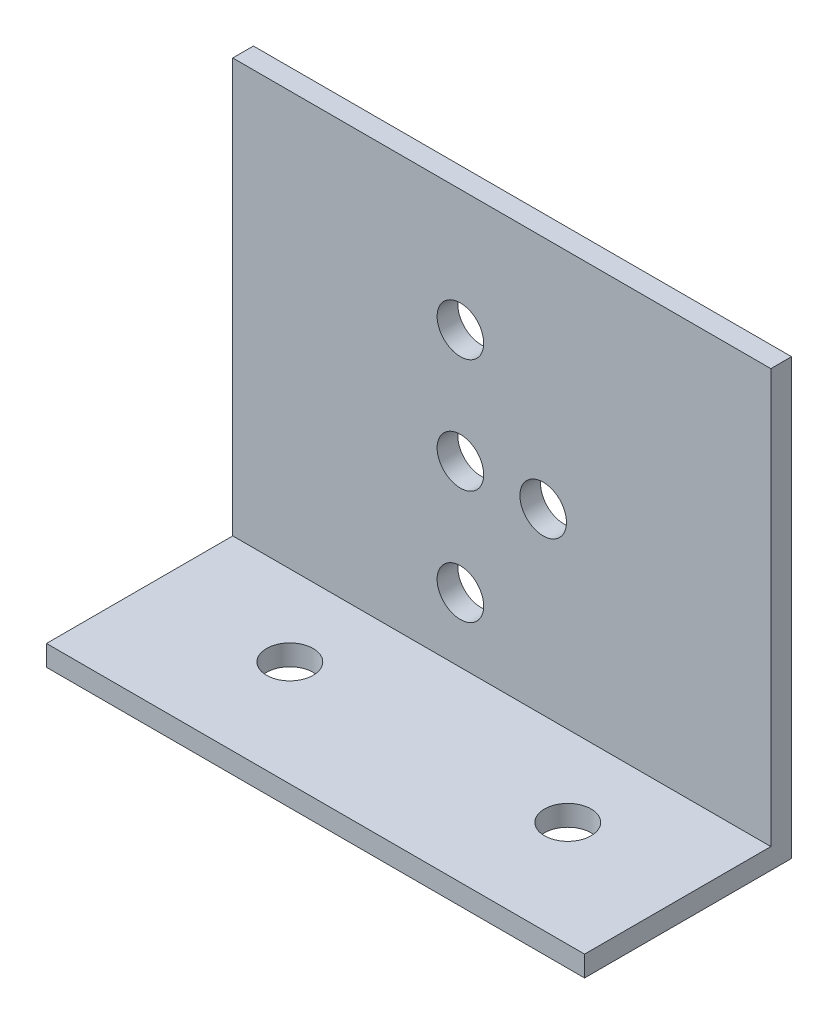
from build123d import *

# Parameters (mm, degrees)
ESQUISSE1_W             = 52
ESQUISSE1_H             = 42
BOSS_EXTRU_1_DEPTH      = 20
ESQUISSE2_W             = 66.008627658
ESQUISSE2_H             = 40.946179855
ENL_V_MAT_EXTRU_1_DEPTH = 40
D_GAGEMENT_M41_D        = 4.5
D_GAGEMENT_M42_D        = 4.5


with BuildPart() as part:
    # Esquisse1 → Boss.-Extru.1 (new body)
    with BuildSketch(Plane.XY):
        Rectangle(ESQUISSE1_W, ESQUISSE1_H)
    extrude(amount=BOSS_EXTRU_1_DEPTH)

    # Esquisse2 → Enlèv. mat.-Extru.1 (cut)
    with BuildSketch(Plane(origin=(0, 21, 0), x_dir=(1, 0, 0), z_dir=(0, 1, 0))):
        with Locations((1.405901571, -22.473089928)):
            Rectangle(ESQUISSE2_W, ESQUISSE2_H)
    extrude(amount=-ENL_V_MAT_EXTRU_1_DEPTH, mode=Mode.SUBTRACT)

    # Dégagement M41 (through all)
    with Locations(Plane(origin=(0, 0, 0), x_dir=(-1, 0, 0), z_dir=(0, 0, -1))):
        with Locations((4, -12.75), (4, -1.75), (4, 9.25), (-4, -1.75)):
            Hole(D_GAGEMENT_M41_D / 2)

    # Dégagement M42 (through all)
    with Locations(Plane(origin=(0, -19, 0), x_dir=(1, 0, 0), z_dir=(0, 1, 0))):
        with Locations((-12.695679618, -9.785063319), (14.163037838, -9.785063319)):
            Hole(D_GAGEMENT_M42_D / 2)


solid = part.part
